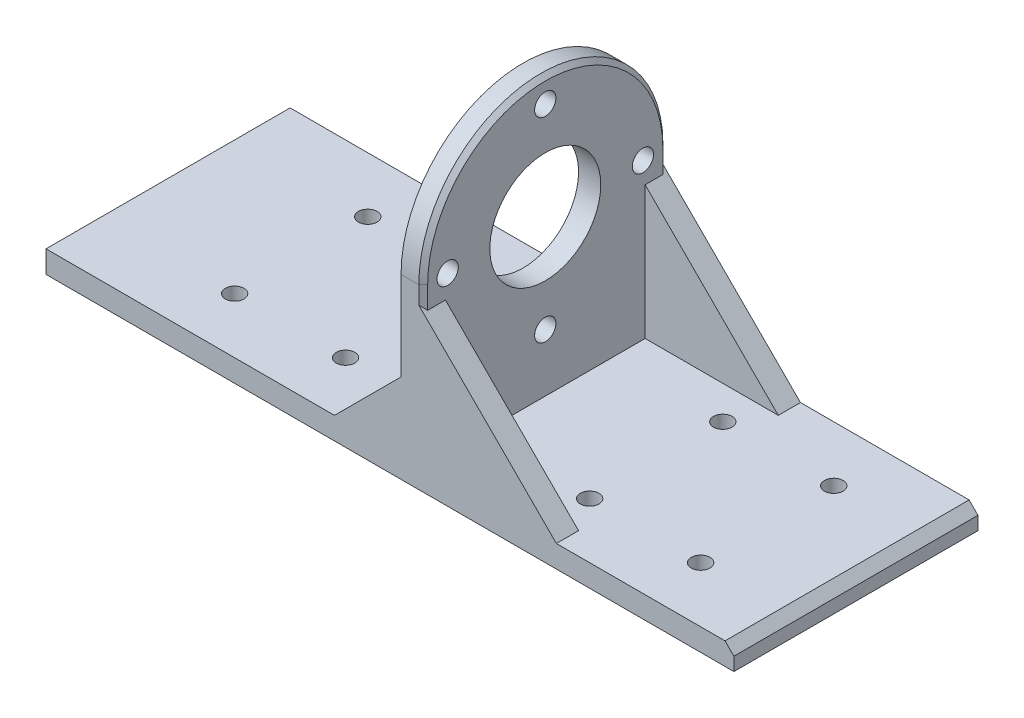
from build123d import *

# Parameters (mm, degrees)
SKETCH_1_R          = 12.5
SKETCH_1_R_2        = 2.4
EXTRUDE_1_DEPTH     = 5
SKETCH_2_W          = 55
SKETCH_2_H          = 5
EXTRUDE_2_DEPTH     = 80
RIB_1_REACH         = 105.712
SKETCH_3_WALL_W     = 230.637888562
SKETCH_3_WALL_H     = 5
CHAMFER_2_SIZE      = 2
SKETCH_4_W          = 55
SKETCH_4_H          = 5
EXTRUDE_3_DEPTH     = 70
RIB_6_REACH         = 105.712
SKETCH_5_WALL_W     = 251.851091998
SKETCH_5_WALL_H     = 5
CUT_EXTRUDE_1_REACH = 107.178
SKETCH_6_R          = 2.1
CHAMFER_3_SIZE      = 1
CHAMFER_4_SIZE      = 2


with BuildPart() as part:
    # 草图1 → 凸台-拉伸1 (new body)
    with BuildSketch(Plane(origin=(0, 0, 0), x_dir=(0, 0, -1), z_dir=(1, 0, 0))):
        with BuildLine():
            Line((-27.5, 0), (-27.5, -40))
            Line((-27.5, -40), (27.5, -40))
            Line((27.5, -40), (27.5, 0))
            ThreePointArc((27.5, 0), (0, 27.5), (-27.5, 0))
        make_face()
        Circle(SKETCH_1_R, mode=Mode.SUBTRACT)
        with Locations((0, 22)):
            Circle(SKETCH_1_R_2, mode=Mode.SUBTRACT)
        with Locations((22, 0)):
            Circle(SKETCH_1_R_2, mode=Mode.SUBTRACT)
        with Locations((0, -22)):
            Circle(SKETCH_1_R_2, mode=Mode.SUBTRACT)
        with Locations((-22, 0)):
            Circle(SKETCH_1_R_2, mode=Mode.SUBTRACT)
    extrude(amount=EXTRUDE_1_DEPTH)

    # 草图2 → 凸台-拉伸2 (add)
    with BuildSketch(Plane.ZY):
        with Locations((0, -37.5)):
            Rectangle(SKETCH_2_W, SKETCH_2_H)
    extrude(amount=EXTRUDE_2_DEPTH)

    # 草图3 wall → 筋1 (add, up to next)
    with BuildSketch(Plane(origin=(-7.5, -27.5, 25), x_dir=(0.707106781187, 0.707106781187, 0), z_dir=(-0.707106781187, 0.707106781187, 0)), mode=Mode.PRIVATE) as rib_1_sk1:
        Rectangle(SKETCH_3_WALL_W, SKETCH_3_WALL_H)
    rib_1_tool1 = extrude(rib_1_sk1.sketch, amount=-RIB_1_REACH, mode=Mode.PRIVATE) - part.part
    rib_1 = rib_1_tool1.solids().sort_by_distance((-7.5, -27.5, 25))[0]
    add(rib_1)

    # 镜向1: 筋1 across plane
    add(rib_1.mirror(Plane.XY))

    # 倒角2
    chamfer_2_edges = [part.edges().sort_by_distance(p)[0] for p in [
        (0, -35, 0),
    ]]
    chamfer(chamfer_2_edges, length=CHAMFER_2_SIZE)

    # 草图4 → 凸台-拉伸3 (add)
    with BuildSketch(Plane(origin=(5, 0, 0), x_dir=(0, 0, -1), z_dir=(1, 0, 0))):
        with Locations((0, -37.5)):
            Rectangle(SKETCH_4_W, SKETCH_4_H)
    extrude(amount=EXTRUDE_3_DEPTH)

    # 草图5 wall → 筋6 (add, up to next)
    with BuildSketch(Plane(origin=(20, -20, 25), x_dir=(-0.707106781187, 0.707106781187, 0), z_dir=(-0.707106781187, -0.707106781187, 0)), mode=Mode.PRIVATE) as rib_6_sk1:
        Rectangle(SKETCH_5_WALL_W, SKETCH_5_WALL_H)
    rib_6_tool1 = extrude(rib_6_sk1.sketch, amount=RIB_6_REACH, mode=Mode.PRIVATE) - part.part
    rib_6 = rib_6_tool1.solids().sort_by_distance((20, -20, 25))[0]
    add(rib_6)

    # 镜向2: 筋6 across plane
    add(rib_6.mirror(Plane.XY))

    # 草图6 → 切除-拉伸1 (cut, up to next)
    with BuildSketch(Plane(origin=(0, -35, 0), x_dir=(1, 0, 0), z_dir=(0, 1, 0)), mode=Mode.PRIVATE) as cut_extrude_1_sk1:
        with Locations(Location((30, 15, 0), (0, 0, 270))):
            Circle(SKETCH_6_R)
    cut_extrude_1_tool1 = extrude(cut_extrude_1_sk1.sketch, amount=-CUT_EXTRUDE_1_REACH, mode=Mode.PRIVATE) & part.part
    # 草图6 → 切除-拉伸1 (cut, up to next)
    with BuildSketch(Plane(origin=(0, -35, 0), x_dir=(1, 0, 0), z_dir=(0, 1, 0)), mode=Mode.PRIVATE) as cut_extrude_1_sk2:
        with Locations(Location((55, 15, 0), (0, 0, 270))):
            Circle(SKETCH_6_R)
    cut_extrude_1_tool2 = extrude(cut_extrude_1_sk2.sketch, amount=-CUT_EXTRUDE_1_REACH, mode=Mode.PRIVATE) & part.part
    # 草图6 → 切除-拉伸1 (cut, up to next)
    with BuildSketch(Plane(origin=(0, -35, 0), x_dir=(1, 0, 0), z_dir=(0, 1, 0)), mode=Mode.PRIVATE) as cut_extrude_1_sk3:
        with Locations(Location((-50, 15, 0), (0, 0, 270))):
            Circle(SKETCH_6_R)
    cut_extrude_1_tool3 = extrude(cut_extrude_1_sk3.sketch, amount=-CUT_EXTRUDE_1_REACH, mode=Mode.PRIVATE) & part.part
    # 草图6 → 切除-拉伸1 (cut, up to next)
    with BuildSketch(Plane(origin=(0, -35, 0), x_dir=(1, 0, 0), z_dir=(0, 1, 0)), mode=Mode.PRIVATE) as cut_extrude_1_sk4:
        with Locations(Location((-25, 15, 0), (0, 0, 270))):
            Circle(SKETCH_6_R)
    cut_extrude_1_tool4 = extrude(cut_extrude_1_sk4.sketch, amount=-CUT_EXTRUDE_1_REACH, mode=Mode.PRIVATE) & part.part
    # 草图6 → 切除-拉伸1 (cut, up to next)
    with BuildSketch(Plane(origin=(0, -35, 0), x_dir=(1, 0, 0), z_dir=(0, 1, 0)), mode=Mode.PRIVATE) as cut_extrude_1_sk5:
        with Locations(Location((55, -15, 0), (0, 0, 270))):
            Circle(SKETCH_6_R)
    cut_extrude_1_tool5 = extrude(cut_extrude_1_sk5.sketch, amount=-CUT_EXTRUDE_1_REACH, mode=Mode.PRIVATE) & part.part
    # 草图6 → 切除-拉伸1 (cut, up to next)
    with BuildSketch(Plane(origin=(0, -35, 0), x_dir=(1, 0, 0), z_dir=(0, 1, 0)), mode=Mode.PRIVATE) as cut_extrude_1_sk6:
        with Locations(Location((30, -15, 0), (0, 0, 270))):
            Circle(SKETCH_6_R)
    cut_extrude_1_tool6 = extrude(cut_extrude_1_sk6.sketch, amount=-CUT_EXTRUDE_1_REACH, mode=Mode.PRIVATE) & part.part
    # 草图6 → 切除-拉伸1 (cut, up to next)
    with BuildSketch(Plane(origin=(0, -35, 0), x_dir=(1, 0, 0), z_dir=(0, 1, 0)), mode=Mode.PRIVATE) as cut_extrude_1_sk7:
        with Locations(Location((-25, -15, 0), (0, 0, 270))):
            Circle(SKETCH_6_R)
    cut_extrude_1_tool7 = extrude(cut_extrude_1_sk7.sketch, amount=-CUT_EXTRUDE_1_REACH, mode=Mode.PRIVATE) & part.part
    # 草图6 → 切除-拉伸1 (cut, up to next)
    with BuildSketch(Plane(origin=(0, -35, 0), x_dir=(1, 0, 0), z_dir=(0, 1, 0)), mode=Mode.PRIVATE) as cut_extrude_1_sk8:
        with Locations(Location((-50, -15, 0), (0, 0, 270))):
            Circle(SKETCH_6_R)
    cut_extrude_1_tool8 = extrude(cut_extrude_1_sk8.sketch, amount=-CUT_EXTRUDE_1_REACH, mode=Mode.PRIVATE) & part.part
    add(cut_extrude_1_tool1.solids().sort_by_distance((30, -35, -15))[0], mode=Mode.SUBTRACT)
    add(cut_extrude_1_tool2.solids().sort_by_distance((55, -35, -15))[0], mode=Mode.SUBTRACT)
    add(cut_extrude_1_tool3.solids().sort_by_distance((-50, -35, -15))[0], mode=Mode.SUBTRACT)
    add(cut_extrude_1_tool4.solids().sort_by_distance((-25, -35, -15))[0], mode=Mode.SUBTRACT)
    add(cut_extrude_1_tool5.solids().sort_by_distance((55, -35, 15))[0], mode=Mode.SUBTRACT)
    add(cut_extrude_1_tool6.solids().sort_by_distance((30, -35, 15))[0], mode=Mode.SUBTRACT)
    add(cut_extrude_1_tool7.solids().sort_by_distance((-25, -35, 15))[0], mode=Mode.SUBTRACT)
    add(cut_extrude_1_tool8.solids().sort_by_distance((-50, -35, 15))[0], mode=Mode.SUBTRACT)

    # 倒角3
    chamfer_3_edges = [part.edges().sort_by_distance(p)[0] for p in [
        (5, -2.5, -27.5),
        (5, 27.5, 0),
        (5, -2.5, 27.5),
    ]]
    chamfer(chamfer_3_edges, length=CHAMFER_3_SIZE)

    # 倒角4
    chamfer_4_edges = [part.edges().sort_by_distance(p)[0] for p in [
        (75, -35, 0),
    ]]
    chamfer(chamfer_4_edges, length=CHAMFER_4_SIZE)


solid = part.part
